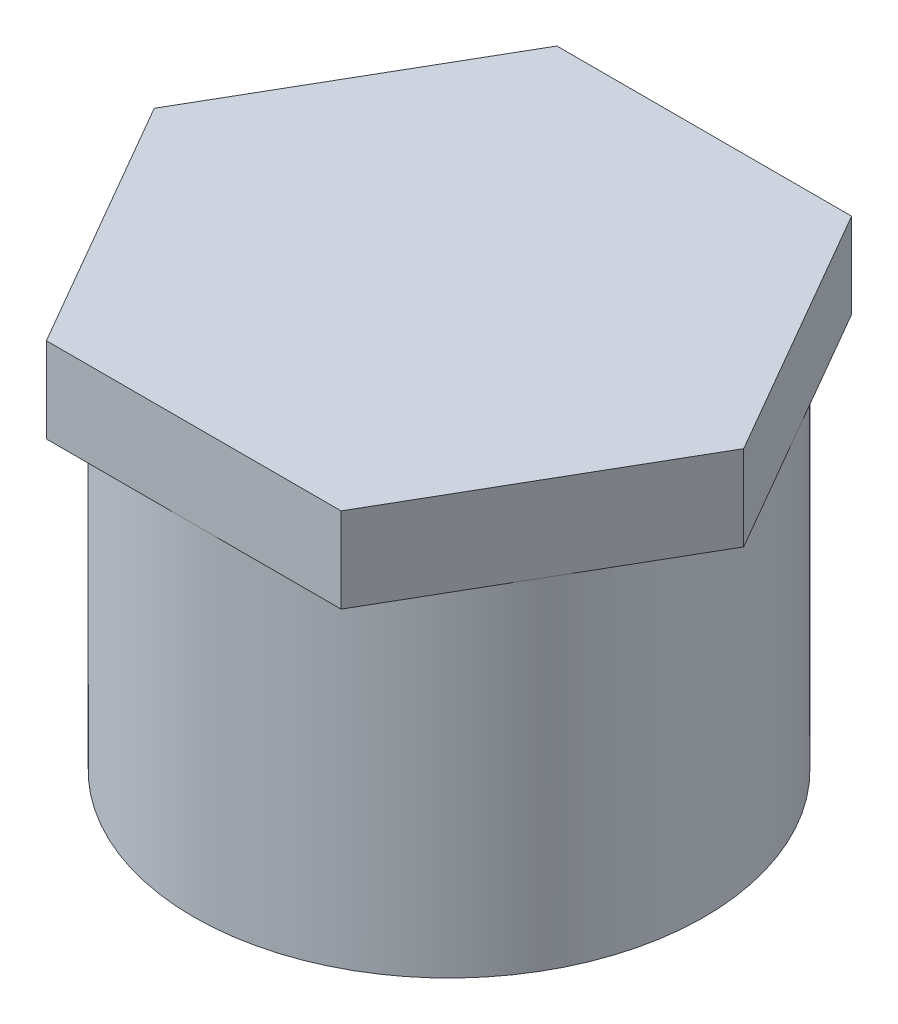
from build123d import *

# Parameters (mm, degrees)
SKETCH1_R           = 3.81
BOSS_EXTRUDE1_DEPTH = 5.08
BOSS_EXTRUDE2_DEPTH = 1.27


with BuildPart() as part:
    # Sketch1 → Boss-Extrude1 (new body)
    with BuildSketch(Plane(origin=(0, 0, 0), x_dir=(1, 0, 0), z_dir=(0, 1, 0))):
        with Locations(Location((0, 0, 0), (0, 0, 270))):
            Circle(SKETCH1_R)
    extrude(amount=BOSS_EXTRUDE1_DEPTH)

    # Sketch2 → Boss-Extrude2 (add)
    with BuildSketch(Plane(origin=(0, 5.08, 0), x_dir=(1, 0, 0), z_dir=(0, 1, 0))):
        Polygon((-2.199704526, 3.81), (2.199704526, 3.81), (4.399409051, 0), (2.199704526, -3.81), (-2.199704526, -3.81), (-4.399409051, 0), align=None)
    extrude(amount=BOSS_EXTRUDE2_DEPTH)


solid = part.part
